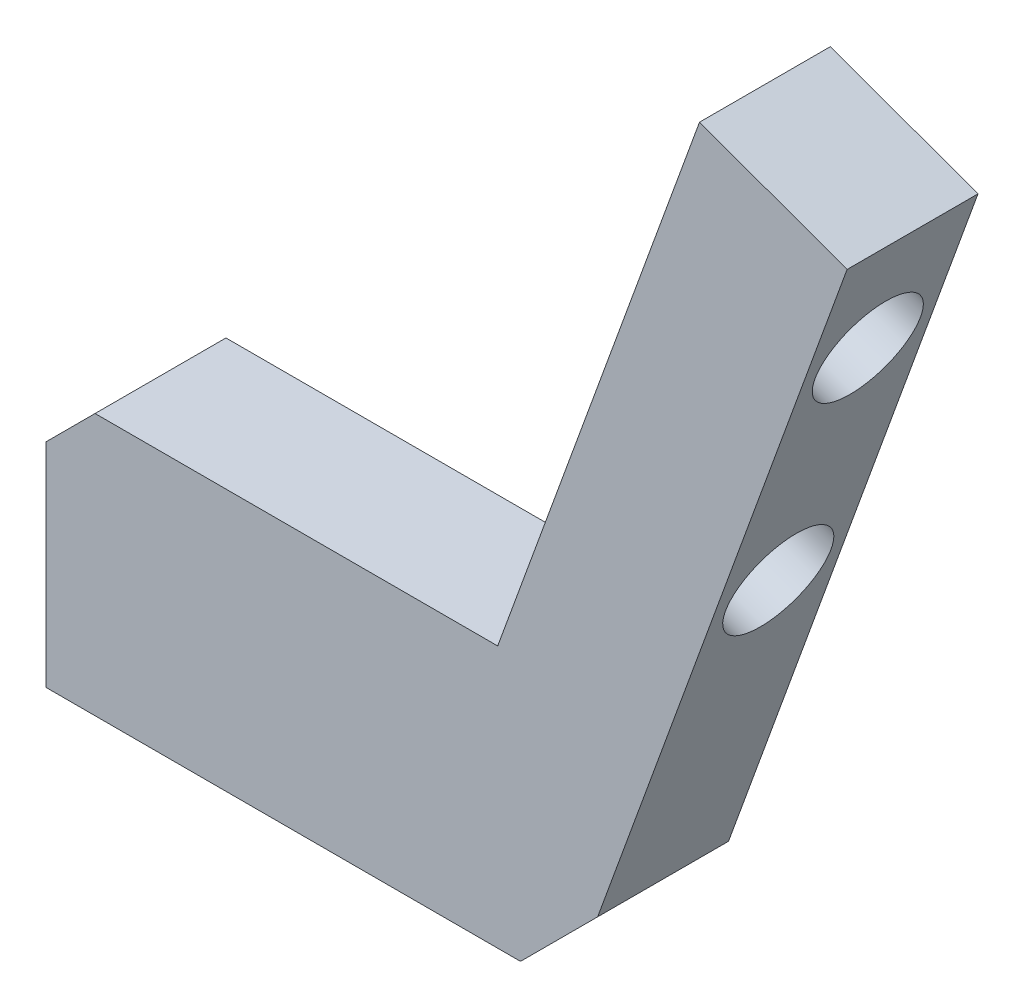
from build123d import *
from OCP.BRepFilletAPI import BRepFilletAPI_MakeChamfer

# Parameters (mm, degrees)
BOSS_EXTRUDE1_DEPTH            = 3.175
TAP_DRILL_FOR_10_24_TAP1_D     = 3.7973
TAP_DRILL_FOR_10_24_TAP1_DEPTH = 10.16
TAP_DRILL_FOR_10_24_TAP1_TIP   = 1.140824014
CHAMFER1_SIZE                  = 2.38
CHAMFER1_SIZE2                 = 3.982114101
F_10_CLEARANCE_HOLE1_D         = 5.1054
F_10_CLEARANCE_HOLE1_DEPTH     = 12.7
F_10_CLEARANCE_HOLE1_TIP       = 1.533816902


with BuildPart() as part:
    # Sketch1 → Boss-Extrude1 (new, symmetric)
    with BuildSketch(Plane.XY):
        Polygon((-25.4, 0), (0, 0), (13.465333043, 36.99569848), (6.304875272, 39.601891972), (-3.486612651, 12.7), (-25.4, 12.7), align=None)
    extrude(amount=BOSS_EXTRUDE1_DEPTH, both=True)

    # Tap Drill for #10-24 Tap1
    with Locations(Plane(origin=(0, 0, 0), x_dir=(-1, 0, 0), z_dir=(0, -1, 0))):
        with Locations((22.225, 0), (9.525, 0)):
            Hole(TAP_DRILL_FOR_10_24_TAP1_D / 2, depth=TAP_DRILL_FOR_10_24_TAP1_DEPTH)
            with Locations((0, 0, -(TAP_DRILL_FOR_10_24_TAP1_DEPTH + TAP_DRILL_FOR_10_24_TAP1_TIP / 2))):  # 118° drill point
                Cone(0, TAP_DRILL_FOR_10_24_TAP1_D / 2, TAP_DRILL_FOR_10_24_TAP1_TIP, mode=Mode.SUBTRACT)

    # Chamfer1: one chamfer whose edges measure the first distance from different faces: ONE call of the kernel's chamfer builder (chamfer() names one face for all edges)
    chamfer1_edges_1 = [part.edges().sort_by_distance(p)[0] for p in [
        (-25.4, 12.7, 0),
    ]]
    chamfer1_edges_2 = [part.edges().sort_by_distance(p)[0] for p in [
        (0, 0, 0),
    ]]
    chamfer1_side_2 = [part.faces().sort_by_distance(p)[0] for p in [
        (-12.181289405, 0, 0),
    ]]
    chamfer1 = BRepFilletAPI_MakeChamfer(part.part.solid().wrapped)
    for e in chamfer1_edges_1:
        chamfer1.Add(CHAMFER1_SIZE, e.wrapped)
    for e in chamfer1_edges_2:
        chamfer1.Add(CHAMFER1_SIZE, CHAMFER1_SIZE2, e.wrapped, chamfer1_side_2[0].wrapped)  # the first distance lies on this face
    add(Compound.cast(chamfer1.Shape()), mode=Mode.REPLACE)

    # #10 Clearance Hole1
    with Locations(Plane(origin=(0, 0, 0), x_dir=(0, 0, -1), z_dir=(0.9396926207859096, -0.3420201433256657, 0))):
        with Locations((0, 33.02), (0, 20.32)):
            Hole(F_10_CLEARANCE_HOLE1_D / 2, depth=F_10_CLEARANCE_HOLE1_DEPTH)
            with Locations((0, 0, -(F_10_CLEARANCE_HOLE1_DEPTH + F_10_CLEARANCE_HOLE1_TIP / 2))):  # 118° drill point
                Cone(0, F_10_CLEARANCE_HOLE1_D / 2, F_10_CLEARANCE_HOLE1_TIP, mode=Mode.SUBTRACT)


solid = part.part
